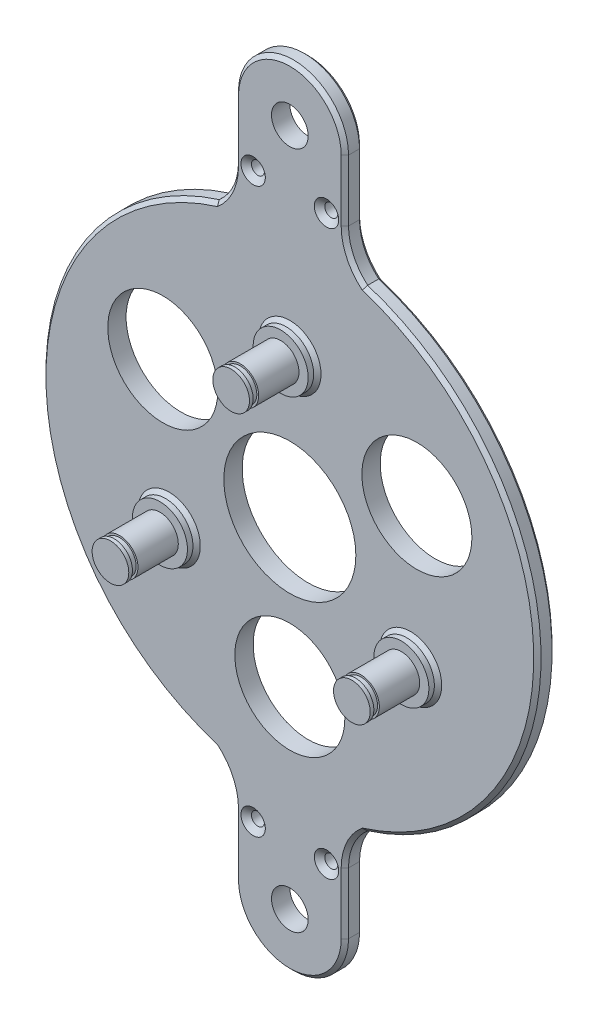
from build123d import *

# Parameters (mm, degrees)
SKETCH1_R                                         = 85.725
BOSS_EXTRUDE1_DEPTH                               = 6.35
SKETCH2_R                                         = 6.35
BOSS_EXTRUDE2_DEPTH                               = 26.67
SKETCH6_R                                         = 22.86
CUT_EXTRUDE1_DEPTH                                = 6.35
CUT_EXTRUDE3_REACH                                = 126.132
SKETCH10_R                                        = 19.05
SKETCH11_R                                        = 9.525
BOSS_EXTRUDE3_DEPTH                               = 9.525
SKETCH12_W                                        = 1.905
SKETCH12_H                                        = 1.27
CIRPATTERN6_COUNT                                 = 3
CIRPATTERN7_COUNT                                 = 3
CHAMFER2_SIZE                                     = 1.27
SKETCH13_W                                        = 38.1
SKETCH13_H                                        = 54.266652261
BOSS_EXTRUDE5_DEPTH                               = 6.35
CIRPATTERN8_COUNT                                 = 3
FILLET1_RADIUS                                    = 19.05
FILLET1_LENGTH                                    = 6.35
BOSS_EXTRUDE9_DEPTH                               = 6.35
CSK_FOR_8_FLAT_HEAD_MACHINE_SCREW_100_D           = 4.4958
CSK_FOR_8_FLAT_HEAD_MACHINE_SCREW_100_CSINK_D     = 8.4328
CSK_FOR_8_FLAT_HEAD_MACHINE_SCREW_100_CSINK_ANGLE = 100
F_1_2_0_5_DIAMETER_HOLE2_D                        = 12.7
MIRROR3_COPY_1_DEPTH                              = 6.35
FILLET1_OF_MIRROR3_2_RADIUS                       = 19.05
FILLET1_OF_MIRROR3_2_LENGTH                       = 6.35
CHAMFER3_SIZE                                     = 1.27


with BuildPart() as part:
    # Sketch1 → Boss-Extrude1 (new body)
    with BuildSketch(Plane.XY):
        Circle(SKETCH1_R)
    extrude(amount=BOSS_EXTRUDE1_DEPTH)

    # Sketch2 → Boss-Extrude2 (add)
    with BuildSketch(Plane.XY):
        with Locations((41.794385987, -24.13)):
            Circle(SKETCH2_R)
        with Locations((0, 48.26)):
            Circle(SKETCH2_R)
        with Locations((-41.794385987, -24.13)):
            Circle(SKETCH2_R)
    extrude(amount=BOSS_EXTRUDE2_DEPTH)

    # Sketch6 → Cut-Extrude1 (cut)
    with BuildSketch(Plane.XY):
        Circle(SKETCH6_R)
    extrude(amount=CUT_EXTRUDE1_DEPTH, mode=Mode.SUBTRACT)

    # Sketch10 → Cut-Extrude3 (cut, up to next)
    with BuildSketch(Plane.XY, mode=Mode.PRIVATE) as cut_extrude3_sk1:
        with Locations((43.994090512, 25.4)):
            Circle(SKETCH10_R)
    cut_extrude3_tool1 = extrude(cut_extrude3_sk1.sketch, amount=CUT_EXTRUDE3_REACH, mode=Mode.PRIVATE) & part.part
    cut_extrude3 = cut_extrude3_tool1.solids().sort_by_distance((43.994091, 25.4, 0))[0]
    add(cut_extrude3, mode=Mode.SUBTRACT)

    # Sketch11 → Boss-Extrude3 (add)
    with BuildSketch(Plane.XY):
        with Locations(Location((0, 48.26, 0), (0, 0, 180))):
            Circle(SKETCH11_R)
    boss_extrude3 = extrude(amount=BOSS_EXTRUDE3_DEPTH)

    # Sketch12 → Cut-Revolve1 (revolve, cut)
    with BuildSketch(Plane(origin=(0, 0, 0), x_dir=(0, 0, -1), z_dir=(1, 0, 0)), mode=Mode.PRIVATE) as cut_revolve1_sk:
        with Locations((-24.4475, 54.61)):
            Rectangle(SKETCH12_W, SKETCH12_H)
    cut_revolve1 = revolve(cut_revolve1_sk.sketch.rotate(Axis((0, 48.26, 26.67), (0, 0, 1)), 90), axis=Axis((0, 48.26, 26.67), (0, 0, 1)), mode=Mode.SUBTRACT)

    # CirPattern6: Boss-Extrude3 ×3 about axis
    cirpattern6_axis = Axis((0, 0, 0), (0, 0, 1))
    for i in range(1, CIRPATTERN6_COUNT):
        add(boss_extrude3.rotate(cirpattern6_axis, i * 360 / CIRPATTERN6_COUNT))

    # CirPattern7: Cut-Revolve1 ×3 about axis
    cirpattern7_axis = Axis((0, 0, 0), (0, 0, 1))
    for i in range(1, CIRPATTERN7_COUNT):
        add(cut_revolve1.rotate(cirpattern7_axis, i * 360 / CIRPATTERN7_COUNT), mode=Mode.SUBTRACT)

    # Chamfer2
    chamfer2_edges = [part.edges().sort_by_distance(p)[0] for p in [
        (-85.725, 0, 0),
        (9.525, 48.26, 6.35),
        (-46.556885987, -15.881108029, 6.35),
        (-85.725, 0, 6.35),
        (37.031885987, -32.378891971, 6.35),
    ]]
    chamfer(chamfer2_edges, length=CHAMFER2_SIZE)

    # Sketch13 → Boss-Extrude5 (add)
    with BuildSketch(Plane.XY):
        with Locations((0, 109.411783366)):
            Rectangle(SKETCH13_W, SKETCH13_H)
    boss_extrude5 = extrude(amount=BOSS_EXTRUDE5_DEPTH)

    # CirPattern8: Cut-Extrude3 ×3 about axis
    cirpattern8_axis = Axis((0, 0, 0), (0, 0, 1))
    for i in range(1, CIRPATTERN8_COUNT):
        add(cut_extrude3.rotate(cirpattern8_axis, i * 360 / CIRPATTERN8_COUNT), mode=Mode.SUBTRACT)

    # Fillet1: full round fillet: the end face becomes a half cylinder, R = half its width
    fillet1_face = Plane((0, 136.545109496, 3.175), x_dir=(0, 0, -1), z_dir=(0, 1, 0))  # on the end face: x along it, z out of the body
    fillet1_slab = fillet1_face.offset(-FILLET1_RADIUS / 2) * Box(FILLET1_LENGTH, 2 * FILLET1_RADIUS, FILLET1_RADIUS, mode=Mode.PRIVATE)  # the body's end, R deep
    fillet1_round = Plane((0, 117.495109496, 3.175), x_dir=(0, 1, 0), z_dir=(0, 0, -1)) * Cylinder(FILLET1_RADIUS, FILLET1_LENGTH, mode=Mode.PRIVATE)  # its axis R under the face
    add(fillet1_slab - fillet1_round, mode=Mode.SUBTRACT)

    # Sketch25 → Boss-Extrude9 (add)
    with BuildSketch(Plane.XY):
        with BuildLine():
            Line((-19.05, 96.237596733), (-19.05, 82.278457235))
            ThreePointArc((-19.05, 82.278457235), (-25.139009769, 80.626777269), (-31.087730061, 78.525155617))
            ThreePointArc((-31.087730061, 78.525155617), (-22.344267038, 85.52968476), (-19.05, 96.237596733))
        make_face()
    boss_extrude9 = extrude(amount=BOSS_EXTRUDE9_DEPTH)

    # Mirror1: Boss-Extrude9 across plane
    add(boss_extrude9.mirror(Plane(origin=(0, 0, 0), x_dir=(0, 0, 1), z_dir=(1, 0, 0))))

    # CSK for #8 Flat Head Machine Screw (100)2 (through all)
    with Locations(Plane.XY.offset(6.35)):
        with Locations((-12.7, 97.602206046), (12.7, 97.602206046)):
            csk_for_8_flat_head_machine_screw_100 = CounterSinkHole(CSK_FOR_8_FLAT_HEAD_MACHINE_SCREW_100_D / 2, CSK_FOR_8_FLAT_HEAD_MACHINE_SCREW_100_CSINK_D / 2, counter_sink_angle=CSK_FOR_8_FLAT_HEAD_MACHINE_SCREW_100_CSINK_ANGLE)

    # 1/2 (0.5) Diameter Hole2 (through all)
    with Locations(Plane.XY.offset(6.35)):
        with Locations((0, 117.495109496)):
            f_1_2_0_5_diameter_hole2 = Hole(F_1_2_0_5_DIAMETER_HOLE2_D / 2)

    # Mirror3: Boss-Extrude5, Boss-Extrude9, CSK for #8 Flat Head Machine Screw (100)2, 1/2 (0.5) Diameter Hole2 across plane
    add(boss_extrude5.mirror(Plane.ZX))
    add(boss_extrude9.mirror(Plane.ZX))
    add(csk_for_8_flat_head_machine_screw_100.mirror(Plane.ZX), mode=Mode.SUBTRACT)
    add(f_1_2_0_5_diameter_hole2.mirror(Plane.ZX), mode=Mode.SUBTRACT)

    # Mirror3 copy 1 sketch → Mirror3 copy 1 (add)
    with BuildSketch(Plane(origin=(0, 0, 0), x_dir=(-1, 0, 0), z_dir=(0, 0, 1))):
        with BuildLine():
            Line((-19.05, 96.237596733), (-19.05, 82.278457235))
            ThreePointArc((-19.05, 82.278457235), (-25.139009769, 80.626777269), (-31.087730061, 78.525155617))
            ThreePointArc((-31.087730061, 78.525155617), (-22.344267038, 85.52968476), (-19.05, 96.237596733))
        make_face()
    extrude(amount=MIRROR3_COPY_1_DEPTH)

    # Fillet1 of Mirror3 2: full round fillet: the end face becomes a half cylinder, R = half its width
    fillet1_of_mirror3_2_face = Plane((0, -136.545109496, 3.175), x_dir=(0, 0, -1), z_dir=(0, -1, 0))  # on the end face: x along it, z out of the body
    fillet1_of_mirror3_2_slab = fillet1_of_mirror3_2_face.offset(-FILLET1_OF_MIRROR3_2_RADIUS / 2) * Box(FILLET1_OF_MIRROR3_2_LENGTH, 2 * FILLET1_OF_MIRROR3_2_RADIUS, FILLET1_OF_MIRROR3_2_RADIUS, mode=Mode.PRIVATE)  # the body's end, R deep
    fillet1_of_mirror3_2_round = Plane((0, -117.495109496, 3.175), x_dir=(0, -1, 0), z_dir=(0, 0, -1)) * Cylinder(FILLET1_OF_MIRROR3_2_RADIUS, FILLET1_OF_MIRROR3_2_LENGTH, mode=Mode.PRIVATE)  # its axis R under the face
    add(fillet1_of_mirror3_2_slab - fillet1_of_mirror3_2_round, mode=Mode.SUBTRACT)

    # Chamfer3
    chamfer3_edges = [part.edges().sort_by_distance(p)[0] for p in [
        (-19.05, 106.866353115, 6.35),
        (-19.05, 106.866353115, 0),
        (0, 136.545109496, 6.35),
        (0, 136.545109496, 0),
        (-22.344267038, 85.52968476, 0),
        (-22.344267038, 85.52968476, 6.35),
        (19.05, 106.866353115, 0),
        (19.05, 106.866353115, 6.35),
        (22.344267038, 85.52968476, 6.35),
        (22.344267038, 85.52968476, 0),
        (-19.05, -106.866353115, 6.35),
        (-19.05, -106.866353115, 0),
        (0, -136.545109496, 0),
        (0, -136.545109496, 6.35),
        (-22.344267038, -85.52968476, 6.35),
        (-22.344267038, -85.52968476, 0),
        (19.05, -106.866353115, 6.35),
        (19.05, -106.866353115, 0),
        (22.344267038, -85.52968476, 0),
        (22.344267038, -85.52968476, 6.35),
    ]]
    chamfer(chamfer3_edges, length=CHAMFER3_SIZE)


solid = part.part
